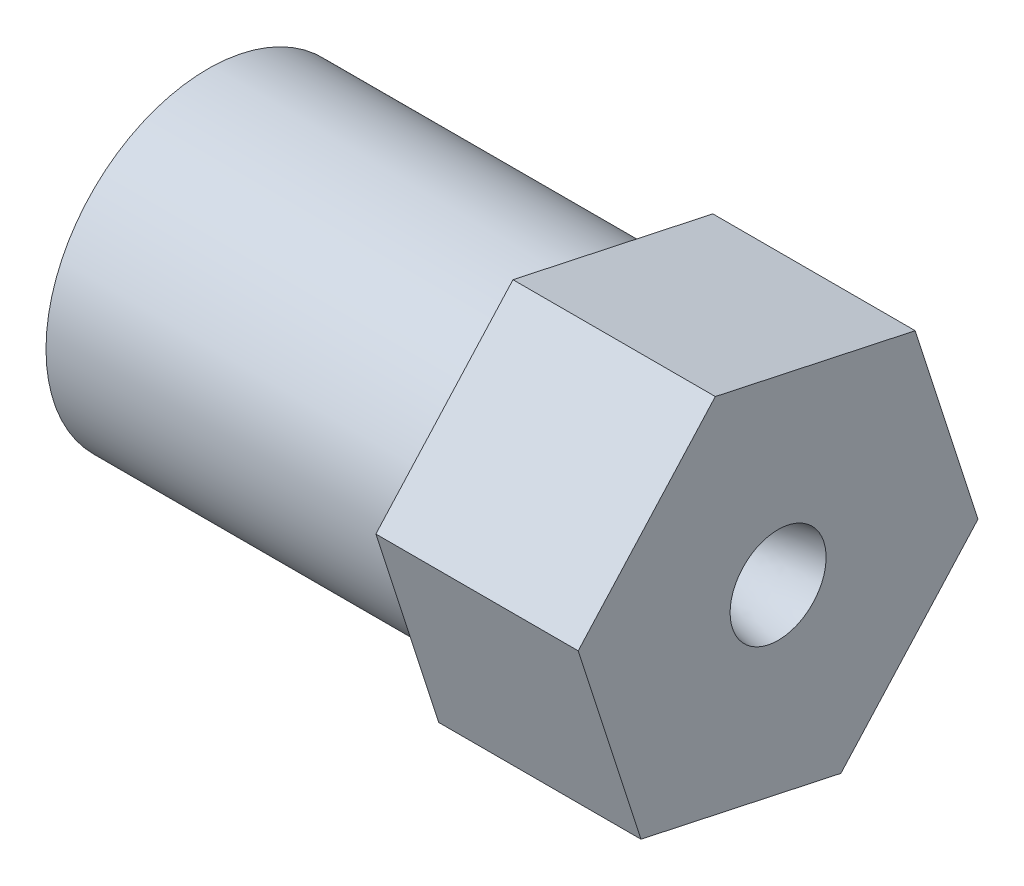
from build123d import *

# Parameters (mm, degrees)
SKETCH4_R           = 10.16
BOSS_EXTRUDE1_DEPTH = 12.7
FILLET1_R           = 0.635


with BuildPart() as part:
    # Sketch1 → Revolve1 (revolve)
    with BuildSketch(Plane.XY, mode=Mode.PRIVATE) as revolve1_sk:
        with BuildLine():
            Line((-2.155261469, 2.924738531), (-2.745586968, 3.51506403))
            ThreePointArc((-2.745586968, 3.51506403), (-3.775631101, 4.203317516), (-4.990650999, 4.445))
            Line((-4.990650999, 4.445), (-13.462, 4.445))
            Line((-13.462, 4.445), (-13.462, 4.699))
            ThreePointArc((-13.462, 4.699), (-13.499197439, 4.788802561), (-13.589, 4.826))
            Line((-13.589, 4.826), (-19.304, 4.826))
            ThreePointArc((-19.304, 4.826), (-19.753012806, 5.011987194), (-19.939, 5.461))
            Line((-19.939, 5.461), (-19.939, 6.8199))
            ThreePointArc((-19.939, 6.8199), (-19.976197439, 6.909702561), (-20.066, 6.9469))
            Line((-20.066, 6.9469), (-24.892, 6.9469))
            Line((-24.892, 6.9469), (-24.892, 7.8994))
            ThreePointArc((-24.892, 7.8994), (-24.929197439, 7.989202561), (-25.019, 8.0264))
            Line((-25.019, 8.0264), (-31.115, 8.0264))
            ThreePointArc((-31.115, 8.0264), (-31.564012806, 8.212387194), (-31.75, 8.6614))
            Line((-31.75, 8.6614), (-31.75, 10.16))
            Line((-31.75, 10.16), (-8.661652823, 10.16))
            Line((-8.661652823, 10.16), (4.038347177, 10.16))
            Line((4.038347177, 10.16), (4.038347177, 3.013943065))
            add(Edge.make_bspline(
                [(4.038347177, 3.013943065), (2.088149887, 2.73986071), (0.277993973, 2.081017838)],
                knots=[0, 0, 0, 1, 1, 1], degree=2))
            ThreePointArc((0.277993973, 2.081017838), (0.141141239, 2.044348258), (0, 2.032))
            ThreePointArc((0, 2.032), (-1.166419102, 2.264015185), (-2.155261469, 2.924738531))
        make_face()
    revolve(revolve1_sk.sketch.rotate(Axis((0, 0, 0), (1, 0, 0)), 90), axis=Axis((0, 0, 0), (1, 0, 0)))

    # Sketch4 → Boss-Extrude1 (add)
    with BuildSketch(Plane(origin=(4.038347177, 0, 0), x_dir=(0, 0, -1), z_dir=(1, 0, 0))):
        Polygon((3.940411868, -12.211607701), (12.545768424, -2.693307071), (8.605356556, 9.51830063), (-3.940411868, 12.211607701), (-12.545768424, 2.693307071), (-8.605356556, -9.51830063), align=None)
        with Locations(Location((0, 0, 0), (0, 0, 180))):
            Circle(SKETCH4_R, mode=Mode.SUBTRACT)
    extrude(amount=-BOSS_EXTRUDE1_DEPTH)

    # Fillet1
    fillet1_edges = [part.edges().sort_by_distance(p)[0] for p in [
        (-8.661652823, 0, -10.16),
    ]]
    fillet(fillet1_edges, radius=FILLET1_R)


solid = part.part
